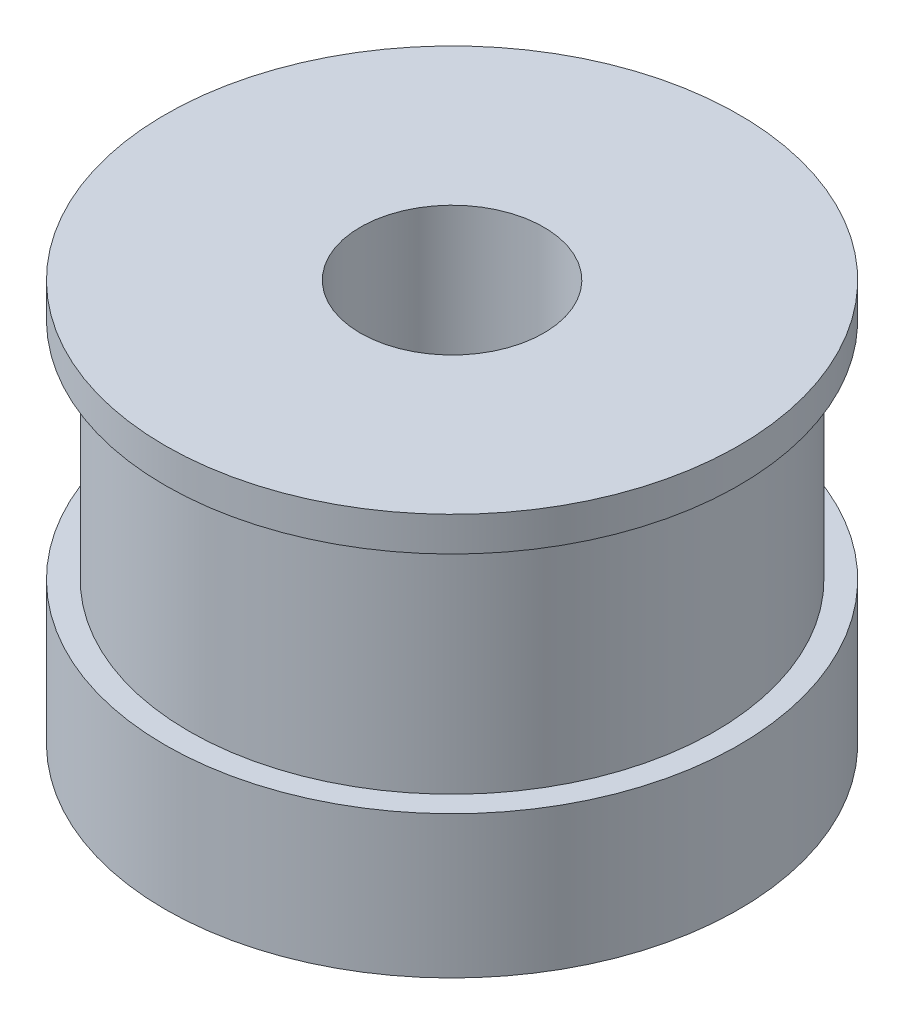
from build123d import *


with BuildPart() as part:
    # Sketch1 → Revolve1 (revolve)
    with BuildSketch(Plane(origin=(0, 0, 0), x_dir=(0, 0, -1), z_dir=(1, 0, 0)), mode=Mode.PRIVATE) as revolve1_sk:
        Polygon((12.5, 7.25), (12.5, 8.75), (4, 8.75), (4, -8.75), (12.5, -8.75), (12.5, -2.55), (11.46, -2.55), (11.46, 7.25), align=None)
    revolve(revolve1_sk.sketch.rotate(Axis((0, 10.31552251, 0), (0, -1, 0)), 180), axis=Axis((0, 10.31552251, 0), (0, -1, 0)))


solid = part.part
